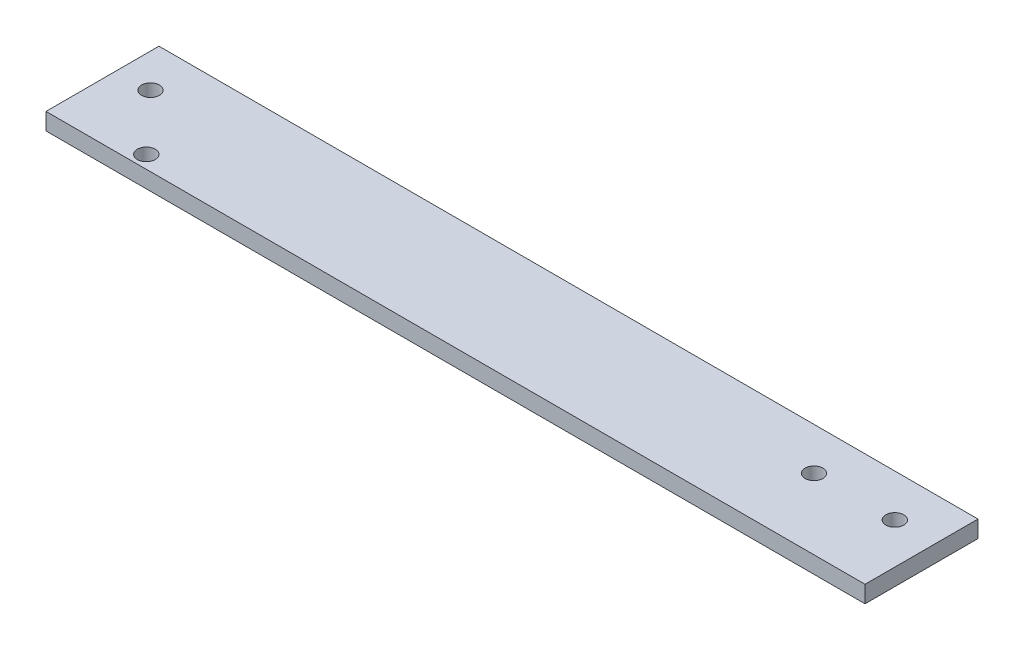
from build123d import *

# Parameters (mm, degrees)
EXTRUDE1_DEPTH = 3
SKETCH2_R      = 1.5875
EXTRUDE2_DEPTH = 3
SKETCH4_R      = 1.59
EXTRUDE3_DEPTH = 3
SKETCH5_R      = 1.59
EXTRUDE5_DEPTH = 3


with BuildPart() as part:
    # Sketch1 → Extrude1 (new body)
    with BuildSketch(Plane(origin=(0, 0, 0), x_dir=(1, 0, 0), z_dir=(0, 1, 0))):
        Polygon((0, 0), (-145, 0), (-145, -20), (-24, -20), (0, -20), align=None)
    extrude(amount=EXTRUDE1_DEPTH)

    # Sketch2 → Extrude2 (cut)
    with BuildSketch(Plane(origin=(0, 3, 0), x_dir=(1, 0, 0), z_dir=(0, 1, 0))):
        with Locations(Location((-139, -7.5, 0), (0, 0, 270))):
            Circle(SKETCH2_R)
        with Locations(Location((-7.2248, -7.5, 0), (0, 0, 270))):
            Circle(SKETCH2_R)
        with Locations((-7.2248, -99.358338)):
            Circle(SKETCH2_R)
    extrude(amount=-EXTRUDE2_DEPTH, mode=Mode.SUBTRACT)

    # Sketch4 → Extrude3 (cut)
    with BuildSketch(Plane(origin=(0, 3, 0), x_dir=(1, 0, 0), z_dir=(0, 1, 0))):
        with Locations(Location((-21.5348, -7.5, 0), (0, 0, 270))):
            Circle(SKETCH4_R)
    extrude(amount=-EXTRUDE3_DEPTH, mode=Mode.SUBTRACT)

    # Sketch5 → Extrude5 (cut)
    with BuildSketch(Plane(origin=(0, 3, 0), x_dir=(1, 0, 0), z_dir=(0, 1, 0))):
        with Locations(Location((-129.5348, -17.71, 0), (0, 0, 270))):
            Circle(SKETCH5_R)
    extrude(amount=-EXTRUDE5_DEPTH, mode=Mode.SUBTRACT)


solid = part.part
